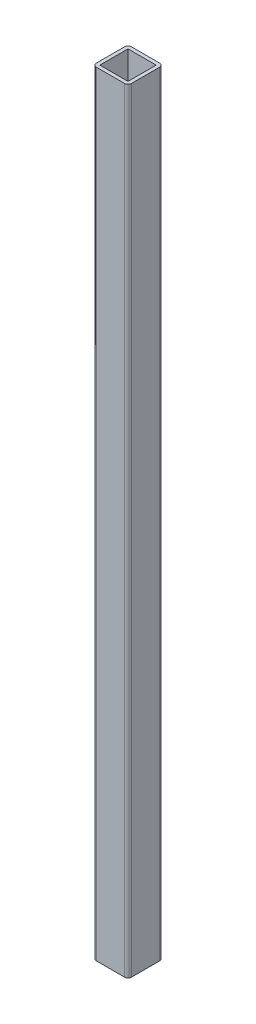
from build123d import *

# Parameters (mm, degrees)
SKETCH4_W           = 25.4
SKETCH4_H           = 25.4
BOSS_EXTRUDE6_DEPTH = 558.8
SHELL1_T            = -2.54
FILLET1_R           = 2.54


with BuildPart() as part:
    # Sketch4 → Boss-Extrude6 (new body)
    with BuildSketch(Plane(origin=(0, 0, 0), x_dir=(1, 0, 0), z_dir=(0, 1, 0))):
        Rectangle(SKETCH4_W, SKETCH4_H)
    extrude(amount=BOSS_EXTRUDE6_DEPTH)

    # Shell1
    shell1_openings = [part.faces().sort_by_distance(p)[0] for p in [
        (0, 558.8, 0),
        (0, 0, 0),
    ]]
    offset(amount=SHELL1_T, openings=shell1_openings, kind=Kind.INTERSECTION)

    # Fillet1
    fillet1_edges = [part.edges().sort_by_distance(p)[0] for p in [
        (12.7, 279.4, -12.7),
        (12.7, 279.4, 12.7),
        (-12.7, 279.4, 12.7),
        (-12.7, 279.4, -12.7),
    ]]
    fillet(fillet1_edges, radius=FILLET1_R)


solid = part.part
